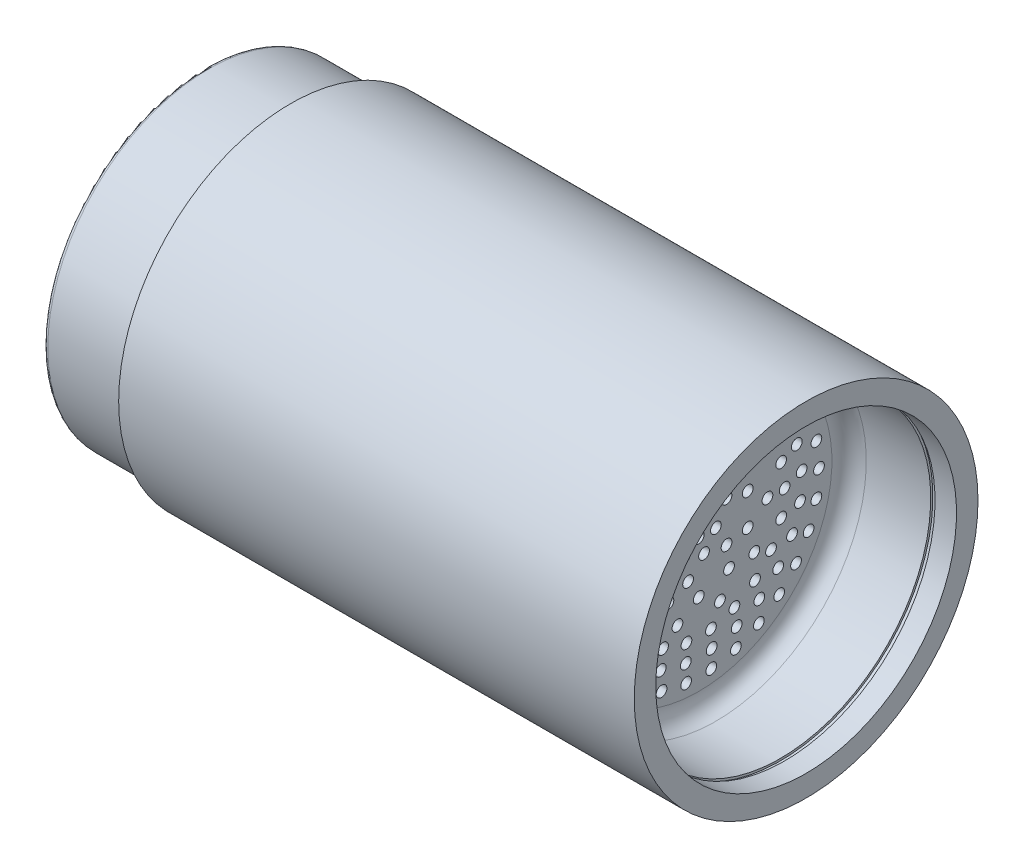
from build123d import *

# Parameters (mm, degrees)
CUT_EXTRUDE1_DEPTH       = 163.763271348
CUT_EXTRUDE1_DEPTH_BACK  = 163.763271348
SKETCH4_R                = 1.5875
BOSS_EXTRUDE1_START      = -50.8
BOSS_EXTRUDE1_DEPTH      = 50.8
REVOLVE2_ANGLE           = 90
BOSS_EXTRUDE2_REACH      = 126.434
SKETCH12_W               = 38.1
SKETCH12_H               = 1.27
BOSS_EXTRUDE3_DEPTH      = 25.4
BOSS_EXTRUDE4_REACH      = 149.481
BOSS_EXTRUDE4_END_RADIUS = 44.45
SKETCH14_R               = 3.6
SKETCH15_W               = 38.1
SKETCH15_H               = 1.27
CUT_EXTRUDE2_DEPTH       = 12.7
FILLET7_R                = 1.27


with BuildPart() as part:
    # Sketch1 → Revolve1 (revolve)
    with BuildSketch(Plane.XY, mode=Mode.PRIVATE) as revolve1_sk:
        with BuildLine():
            Line((112.087340077, -50.8), (-40.312659923, -50.8))
            Line((-40.312659923, -50.8), (-40.312659923, -47.625))
            Line((-40.312659923, -47.625), (-65.712659923, -47.625))
            Line((-65.712659923, -47.625), (-65.712659923, -44.45))
            Line((-65.712659923, -44.45), (68.907340077, -44.45))
            ThreePointArc((68.907340077, -44.45), (72.499442526, -42.962102448), (73.987340077, -39.37))
            Line((73.987340077, -39.37), (73.987340077, 0))
            Line((73.987340077, 0), (80.337340077, 0))
            Line((80.337340077, 0), (80.337340077, -39.37))
            ThreePointArc((80.337340077, -39.37), (81.825237629, -42.962102448), (85.417340077, -44.45))
            Line((85.417340077, -44.45), (104.467340077, -44.45))
            Line((104.467340077, -44.45), (104.467340077, -45.085))
            Line((104.467340077, -45.085), (105.737340077, -45.085))
            Line((105.737340077, -45.085), (105.737340077, -44.45))
            Line((105.737340077, -44.45), (112.087340077, -44.45))
            Line((112.087340077, -44.45), (112.087340077, -50.8))
        make_face()
    revolve(revolve1_sk.sketch.rotate(Axis((0, 0, 0), (1, 0, 0)), 270), axis=Axis((0, 0, 0), (1, 0, 0)))

    # Sketch4 → Cut-Extrude1 (cut, two sides: drawn at the far end of the back side and taken through both)
    with BuildSketch(Plane(origin=(80.337340077, 0, 0), x_dir=(0, 0, -1), z_dir=(1, 0, 0)).offset(-CUT_EXTRUDE1_DEPTH_BACK)):
        Circle(SKETCH4_R)
        with Locations((5.079019932, 0)):
            Circle(SKETCH4_R)
        with Locations((1.569503474, -4.830435003)):
            Circle(SKETCH4_R)
        with Locations((-4.10901344, -2.985373012)):
            Circle(SKETCH4_R)
        with Locations((-4.10901344, 2.985373012)):
            Circle(SKETCH4_R)
        with Locations((0, 15.239019932)):
            Circle(SKETCH4_R)
        with Locations((8.957271175, 12.328626103)):
            Circle(SKETCH4_R)
        with Locations((14.493169208, 4.709116137)):
            Circle(SKETCH4_R)
        with Locations((14.493169208, -4.709116137)):
            Circle(SKETCH4_R)
        with Locations((8.957271175, -12.328626103)):
            Circle(SKETCH4_R)
        with Locations((0, -15.239019932)):
            Circle(SKETCH4_R)
        with Locations((-8.957271175, -12.328626103)):
            Circle(SKETCH4_R)
        with Locations((20.319019932, 0)):
            Circle(SKETCH4_R)
        with Locations((16.438432434, -11.943220257)):
            Circle(SKETCH4_R)
        with Locations((6.278922468, -19.324536311)):
            Circle(SKETCH4_R)
        with Locations((-6.278922468, -19.324536311)):
            Circle(SKETCH4_R)
        with Locations((-16.438432434, -11.943220257)):
            Circle(SKETCH4_R)
        with Locations((-20.319019932, 0)):
            Circle(SKETCH4_R)
        with Locations((-16.438432434, 11.943220257)):
            Circle(SKETCH4_R)
        with Locations((-6.278922468, 19.324536311)):
            Circle(SKETCH4_R)
        with Locations((6.278922468, 19.324536311)):
            Circle(SKETCH4_R)
        with Locations((16.438432434, 11.943220257)):
            Circle(SKETCH4_R)
        with Locations((25.399019932, 0)):
            Circle(SKETCH4_R)
        with Locations((24.370181162, -7.155730827)):
            Circle(SKETCH4_R)
        with Locations((21.367015248, -13.731746899)):
            Circle(SKETCH4_R)
        with Locations((16.632820834, -19.195298503)):
            Circle(SKETCH4_R)
        with Locations((10.551134195, -23.103761181)):
            Circle(SKETCH4_R)
        with Locations((3.614657414, -25.140494532)):
            Circle(SKETCH4_R)
        with Locations((-3.614657414, -25.140494532)):
            Circle(SKETCH4_R)
        with Locations((-10.551134195, -23.103761181)):
            Circle(SKETCH4_R)
        with Locations((-16.632820834, -19.195298503)):
            Circle(SKETCH4_R)
        with Locations((-21.367015248, -13.731746899)):
            Circle(SKETCH4_R)
        with Locations((-24.370181162, -7.155730827)):
            Circle(SKETCH4_R)
        with Locations((-25.399019932, 0)):
            Circle(SKETCH4_R)
        with Locations((0, 30.479019932)):
            Circle(SKETCH4_R)
        with Locations((7.579824028, 29.521465474)):
            Circle(SKETCH4_R)
        with Locations((14.683379835, 26.708968768)):
            Circle(SKETCH4_R)
        with Locations((20.864324886, 22.218249325)):
            Circle(SKETCH4_R)
        with Locations((25.734287671, 16.331475564)):
            Circle(SKETCH4_R)
        with Locations((28.987270517, 9.418535131)):
            Circle(SKETCH4_R)
        with Locations((30.418876549, 1.913793496)):
            Circle(SKETCH4_R)
        with Locations((29.939152694, -5.711198822)):
            Circle(SKETCH4_R)
        with Locations((27.578241767, -12.977335514)):
            Circle(SKETCH4_R)
        with Locations((23.484488485, -19.428058489)):
            Circle(SKETCH4_R)
        with Locations((17.91511842, -24.658045097)):
            Circle(SKETCH4_R)
        with Locations((11.220075579, -28.338676046)):
            Circle(SKETCH4_R)
        with Locations((3.820034124, -30.238683756)):
            Circle(SKETCH4_R)
        with Locations((-3.820034124, -30.238683756)):
            Circle(SKETCH4_R)
        with Locations((35.559019932, 0)):
            Circle(SKETCH4_R)
        with Locations((34.781970031, -7.393135958)):
            Circle(SKETCH4_R)
        with Locations((32.484781137, -14.463156398)):
            Circle(SKETCH4_R)
        with Locations((28.767851428, -20.901067502)):
            Circle(SKETCH4_R)
        with Locations((23.793628569, -26.425501662)):
            Circle(SKETCH4_R)
        with Locations((17.779509966, -30.795014595)):
            Circle(SKETCH4_R)
        with Locations((10.988341462, -33.81863762)):
            Circle(SKETCH4_R)
        with Locations((3.716929709, -35.3642239)):
            Circle(SKETCH4_R)
        with Locations((-3.716929709, -35.3642239)):
            Circle(SKETCH4_R)
        with Locations((-10.988341462, -33.81863762)):
            Circle(SKETCH4_R)
        with Locations((-17.779509966, -30.795014595)):
            Circle(SKETCH4_R)
        with Locations((-23.793628569, -26.425501662)):
            Circle(SKETCH4_R)
        with Locations((-28.767851428, -20.901067502)):
            Circle(SKETCH4_R)
        with Locations((-32.484781137, -14.463156398)):
            Circle(SKETCH4_R)
        with Locations((-34.781970031, -7.393135958)):
            Circle(SKETCH4_R)
        with Locations((-35.559019932, 0)):
            Circle(SKETCH4_R)
        with Locations((-34.781970031, 7.393135958)):
            Circle(SKETCH4_R)
        with Locations((-32.484781137, 14.463156398)):
            Circle(SKETCH4_R)
        with Locations((-28.767851428, 20.901067502)):
            Circle(SKETCH4_R)
        with Locations((-23.793628569, 26.425501662)):
            Circle(SKETCH4_R)
        with Locations((-17.779509966, 30.795014595)):
            Circle(SKETCH4_R)
        with Locations((-10.988341462, 33.81863762)):
            Circle(SKETCH4_R)
        with Locations((-11.220075579, -28.338676046)):
            Circle(SKETCH4_R)
        with Locations((-17.91511842, -24.658045097)):
            Circle(SKETCH4_R)
        with Locations((-23.484488485, -19.428058489)):
            Circle(SKETCH4_R)
        with Locations((-27.578241767, -12.977335514)):
            Circle(SKETCH4_R)
        with Locations((-24.370181162, 7.155730827)):
            Circle(SKETCH4_R)
        with Locations((-21.367015248, 13.731746899)):
            Circle(SKETCH4_R)
        with Locations((-16.632820834, 19.195298503)):
            Circle(SKETCH4_R)
        with Locations((1.569503474, 4.830435003)):
            Circle(SKETCH4_R)
        with Locations((-10.159019932, 0)):
            Circle(SKETCH4_R)
        with Locations((-3.139309805, 9.661802106)):
            Circle(SKETCH4_R)
        with Locations((8.218819771, 5.971322094)):
            Circle(SKETCH4_R)
        with Locations((8.218819771, -5.971322094)):
            Circle(SKETCH4_R)
        with Locations((-3.139309805, -9.661802106)):
            Circle(SKETCH4_R)
        with Locations((-14.493169208, -4.709116137)):
            Circle(SKETCH4_R)
        with Locations((-14.493169208, 4.709116137)):
            Circle(SKETCH4_R)
        with Locations((-8.957271175, 12.328626103)):
            Circle(SKETCH4_R)
        with Locations((-10.551134195, 23.103761181)):
            Circle(SKETCH4_R)
        with Locations((-3.614657414, 25.140494532)):
            Circle(SKETCH4_R)
        with Locations((3.614657414, 25.140494532)):
            Circle(SKETCH4_R)
        with Locations((-29.939152694, -5.711198822)):
            Circle(SKETCH4_R)
        with Locations((-30.418876549, 1.913793496)):
            Circle(SKETCH4_R)
        with Locations((-28.987270517, 9.418535131)):
            Circle(SKETCH4_R)
        with Locations((-25.734287671, 16.331475564)):
            Circle(SKETCH4_R)
        with Locations((-20.864324886, 22.218249325)):
            Circle(SKETCH4_R)
        with Locations((-14.683379835, 26.708968768)):
            Circle(SKETCH4_R)
        with Locations((-7.579824028, 29.521465474)):
            Circle(SKETCH4_R)
        with Locations((-3.716929709, 35.3642239)):
            Circle(SKETCH4_R)
        with Locations((3.716929709, 35.3642239)):
            Circle(SKETCH4_R)
        with Locations((10.988341462, 33.81863762)):
            Circle(SKETCH4_R)
        with Locations((17.779509966, 30.795014595)):
            Circle(SKETCH4_R)
        with Locations((23.793628569, 26.425501662)):
            Circle(SKETCH4_R)
        with Locations((28.767851428, 20.901067502)):
            Circle(SKETCH4_R)
        with Locations((32.484781137, 14.463156398)):
            Circle(SKETCH4_R)
        with Locations((34.781970031, 7.393135958)):
            Circle(SKETCH4_R)
        with Locations((10.551134195, 23.103761181)):
            Circle(SKETCH4_R)
        with Locations((16.632820834, 19.195298503)):
            Circle(SKETCH4_R)
        with Locations((21.367015248, 13.731746899)):
            Circle(SKETCH4_R)
        with Locations((24.370181162, 7.155730827)):
            Circle(SKETCH4_R)
    extrude(amount=CUT_EXTRUDE1_DEPTH + CUT_EXTRUDE1_DEPTH_BACK, mode=Mode.SUBTRACT)

    # Sketch5 → Boss-Extrude1 (add)
    with BuildSketch(Plane.ZY.offset(-10.487340077).offset(BOSS_EXTRUDE1_START)):
        with BuildLine():
            ThreePointArc((-9.976026248, 43.316063998), (0, 34.409735534), (9.976026248, 43.316063998))
            ThreePointArc((9.976026248, 43.316063998), (11.219501152, 43.010757886), (12.453666563, 42.669763172))
            ThreePointArc((12.453666563, 42.669763172), (0, 31.869735534), (-12.453666563, 42.669763172))
            ThreePointArc((-12.453666563, 42.669763172), (-11.219501152, 43.010757886), (-9.976026248, 43.316063998))
        make_face()
    extrude(amount=BOSS_EXTRUDE1_DEPTH)

    # Sketch10 → Revolve2 (revolve)
    with BuildSketch(Plane(origin=(61.287340077, 0, 0), x_dir=(0, 0, -1), z_dir=(1, 0, 0))):
        with BuildLine():
            ThreePointArc((-9.976026248, 43.316063998), (0, 34.409735534), (9.976026248, 43.316063998))
            ThreePointArc((9.976026248, 43.316063998), (11.219501152, 43.010757886), (12.453666563, 42.669763172))
            ThreePointArc((12.453666563, 42.669763172), (0, 31.869735534), (-12.453666563, 42.669763172))
            ThreePointArc((-12.453666563, 42.669763172), (-11.219501152, 43.010757886), (-9.976026248, 43.316063998))
        make_face()
    revolve(axis=Axis((61.287340077, 44.45, 0), (0, 0, 1)), revolution_arc=REVOLVE2_ANGLE)

    # Boss-Extrude2: up to this face of the body (flat: up to its plane)
    boss_extrude2_end = Plane(part.part.faces().sort_by_distance((73.987340077, 0, -38.256448241))[0])
    # Sketch12 → Boss-Extrude2 (add, up to the picked face)
    with BuildSketch(Plane.ZY.offset(-10.487340077), mode=Mode.PRIVATE) as boss_extrude2_sk1:
        with Locations((-26.67, 11.085)):
            Rectangle(SKETCH12_W, SKETCH12_H)
    boss_extrude2_tool1 = split(extrude(boss_extrude2_sk1.sketch, amount=-BOSS_EXTRUDE2_REACH, mode=Mode.PRIVATE), bisect_by=boss_extrude2_end, keep=Keep.BOTH, mode=Mode.PRIVATE)
    # Sketch12 → Boss-Extrude2 (add, up to the picked face)
    with BuildSketch(Plane.ZY.offset(-10.487340077), mode=Mode.PRIVATE) as boss_extrude2_sk2:
        with Locations((-26.67, -11.085)):
            Rectangle(SKETCH12_W, SKETCH12_H)
    boss_extrude2_tool2 = split(extrude(boss_extrude2_sk2.sketch, amount=-BOSS_EXTRUDE2_REACH, mode=Mode.PRIVATE), bisect_by=boss_extrude2_end, keep=Keep.BOTH, mode=Mode.PRIVATE)
    # Sketch12 → Boss-Extrude2 (add, up to the picked face)
    with BuildSketch(Plane.ZY.offset(-10.487340077), mode=Mode.PRIVATE) as boss_extrude2_sk3:
        with Locations((26.67, 11.085)):
            Rectangle(SKETCH12_W, SKETCH12_H)
    boss_extrude2_tool3 = split(extrude(boss_extrude2_sk3.sketch, amount=-BOSS_EXTRUDE2_REACH, mode=Mode.PRIVATE), bisect_by=boss_extrude2_end, keep=Keep.BOTH, mode=Mode.PRIVATE)
    # Sketch12 → Boss-Extrude2 (add, up to the picked face)
    with BuildSketch(Plane.ZY.offset(-10.487340077), mode=Mode.PRIVATE) as boss_extrude2_sk4:
        with Locations((26.67, -11.085)):
            Rectangle(SKETCH12_W, SKETCH12_H)
    boss_extrude2_tool4 = split(extrude(boss_extrude2_sk4.sketch, amount=-BOSS_EXTRUDE2_REACH, mode=Mode.PRIVATE), bisect_by=boss_extrude2_end, keep=Keep.BOTH, mode=Mode.PRIVATE)
    add(boss_extrude2_tool1.solids().sort_by(Axis((10.48734, 11.085, -26.67), (1, 0, 0)))[0])
    add(boss_extrude2_tool2.solids().sort_by(Axis((10.48734, -11.085, -26.67), (1, 0, 0)))[0])
    add(boss_extrude2_tool3.solids().sort_by(Axis((10.48734, 11.085, 26.67), (1, 0, 0)))[0])
    add(boss_extrude2_tool4.solids().sort_by(Axis((10.48734, -11.085, 26.67), (1, 0, 0)))[0])

    # Sketch13 → Boss-Extrude3 (add)
    with BuildSketch(Plane.ZY.offset(-48.587340077)):
        Polygon((19, 0), (19, 10.087519009), (19, 10.45), (20.27, 10.45), (20.27, -10.45), (19, -10.45), align=None)
        Polygon((-19, -10.45), (-19, 0), (-19, 10.087519009), (-19, 10.45), (-20.27, 10.45), (-20.27, -10.45), align=None)
    extrude(amount=-BOSS_EXTRUDE3_DEPTH)

    # Boss-Extrude4: up to this cylinder (the profile starts inside it)
    boss_extrude4_end = Plane(origin=(-16.000433, 0, 0), z_dir=(-1, 0, 0)) * Cylinder(BOSS_EXTRUDE4_END_RADIUS, 440.932, mode=Mode.PRIVATE)
    # Sketch14 → Boss-Extrude4 (add, up to the surface)
    with BuildSketch(Plane(origin=(0, -30.48, 0), x_dir=(1, 0, 0), z_dir=(0, 1, 0)), mode=Mode.PRIVATE) as boss_extrude4_sk1:
        with Locations(Location((10.034567212, -18.738272032, 0), (0, 0, 270))):
            Circle(SKETCH14_R)
    boss_extrude4_tool1 = extrude(boss_extrude4_sk1.sketch, amount=-BOSS_EXTRUDE4_REACH, mode=Mode.PRIVATE) & boss_extrude4_end
    add(boss_extrude4_tool1.solids().sort_by_distance((10.034567, -30.48, 18.738272))[0])
    # Sketch14 → Boss-Extrude4 (add, up to the surface)
    with BuildSketch(Plane(origin=(0, -30.48, 0), x_dir=(1, 0, 0), z_dir=(0, 1, 0)), mode=Mode.PRIVATE) as boss_extrude4_sk2:
        with Locations(Location((10.034567212, 9.201727968, 0), (0, 0, 270))):
            Circle(SKETCH14_R)
    boss_extrude4_tool2 = extrude(boss_extrude4_sk2.sketch, amount=-BOSS_EXTRUDE4_REACH, mode=Mode.PRIVATE) & boss_extrude4_end
    add(boss_extrude4_tool2.solids().sort_by_distance((10.034567, -30.48, -9.201728))[0])
    # Sketch14 → Boss-Extrude4 (add, up to the surface)
    with BuildSketch(Plane(origin=(0, -30.48, 0), x_dir=(1, 0, 0), z_dir=(0, 1, 0)), mode=Mode.PRIVATE) as boss_extrude4_sk3:
        with Locations(Location((-42.035432788, -23.818272032, 0), (0, 0, 270))):
            Circle(SKETCH14_R)
    boss_extrude4_tool3 = extrude(boss_extrude4_sk3.sketch, amount=-BOSS_EXTRUDE4_REACH, mode=Mode.PRIVATE) & boss_extrude4_end
    add(boss_extrude4_tool3.solids().sort_by_distance((-42.035433, -30.48, 23.818272))[0])
    # Sketch14 → Boss-Extrude4 (add, up to the surface)
    with BuildSketch(Plane(origin=(0, -30.48, 0), x_dir=(1, 0, 0), z_dir=(0, 1, 0)), mode=Mode.PRIVATE) as boss_extrude4_sk4:
        with Locations(Location((-40.765432788, 24.441727968, 0), (0, 0, 270))):
            Circle(SKETCH14_R)
    boss_extrude4_tool4 = extrude(boss_extrude4_sk4.sketch, amount=-BOSS_EXTRUDE4_REACH, mode=Mode.PRIVATE) & boss_extrude4_end
    add(boss_extrude4_tool4.solids().sort_by_distance((-40.765433, -30.48, -24.441728))[0])

    # Sketch15 → Cut-Extrude2 (cut)
    with BuildSketch(Plane.ZY.offset(-10.487340077)):
        with Locations((26.67, -11.085)):
            Rectangle(SKETCH15_W, SKETCH15_H)
        with Locations((-26.67, -11.085)):
            Rectangle(SKETCH15_W, SKETCH15_H)
        with Locations((26.67, 11.085)):
            Rectangle(SKETCH15_W, SKETCH15_H)
        with Locations((-26.67, 11.085)):
            Rectangle(SKETCH15_W, SKETCH15_H)
    extrude(amount=-CUT_EXTRUDE2_DEPTH, mode=Mode.SUBTRACT)

    # Fillet7
    fillet7_edges = [part.edges().sort_by_distance(p)[0] for p in [
        (-65.712659923, 0, -47.625),
        (-40.312659923, 0, -47.625),
    ]]
    fillet(fillet7_edges, radius=FILLET7_R)


solid = part.part
